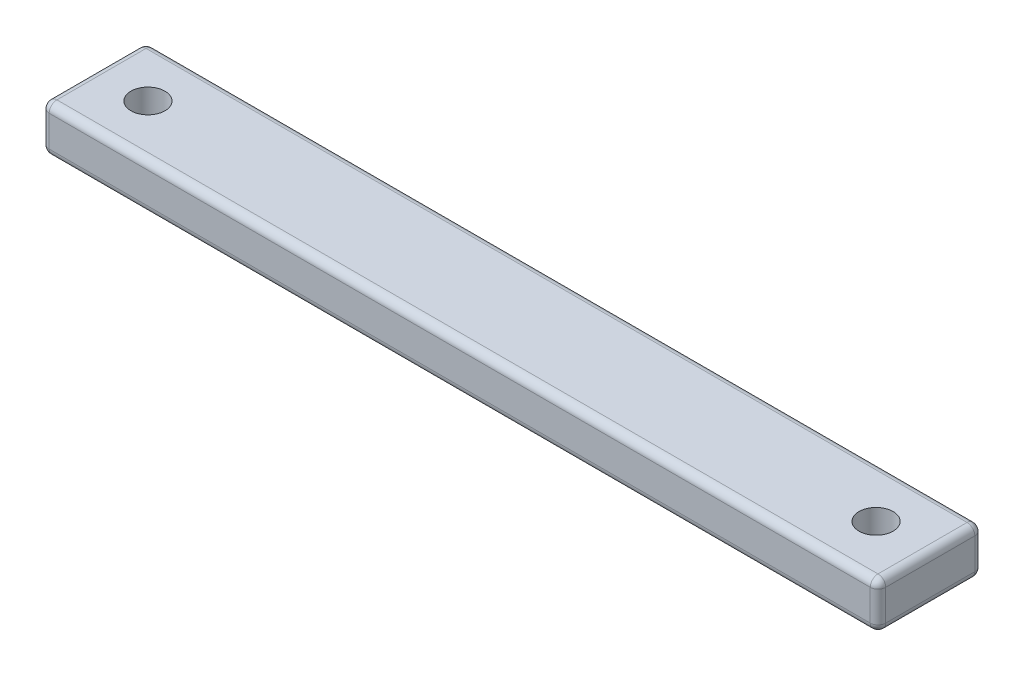
from build123d import *

# Parameters (mm, degrees)
SKETCH1_W           = 54
SKETCH1_H           = 6.75
SKETCH1_R           = 1.1
BOSS_EXTRUDE1_DEPTH = 3
FILLET1_R           = 0.5


with BuildPart() as part:
    # Sketch1 → Boss-Extrude1 (new body)
    with BuildSketch(Plane(origin=(0, 0, 0), x_dir=(1, 0, 0), z_dir=(0, 1, 0))):
        Rectangle(SKETCH1_W, SKETCH1_H)
        with Locations(Location((-23.5, 0, 0), (0, 0, 270))):
            Circle(SKETCH1_R, mode=Mode.SUBTRACT)
        with Locations(Location((23.5, 0, 0), (0, 0, 270))):
            Circle(SKETCH1_R, mode=Mode.SUBTRACT)
    extrude(amount=BOSS_EXTRUDE1_DEPTH)

    # Fillet1
    fillet1_edges = [part.edges().sort_by_distance(p)[0] for p in [
        (-27, 3, 0),
        (0, 3, 3.375),
        (27, 3, 0),
        (0, 0, 3.375),
        (-27, 0, 0),
        (0, 0, -3.375),
        (27, 0, 0),
        (27, 1.5, 3.375),
        (-27, 1.5, 3.375),
        (-27, 1.5, -3.375),
        (27, 1.5, -3.375),
        (0, 3, -3.375),
    ]]
    fillet(fillet1_edges, radius=FILLET1_R)


solid = part.part
